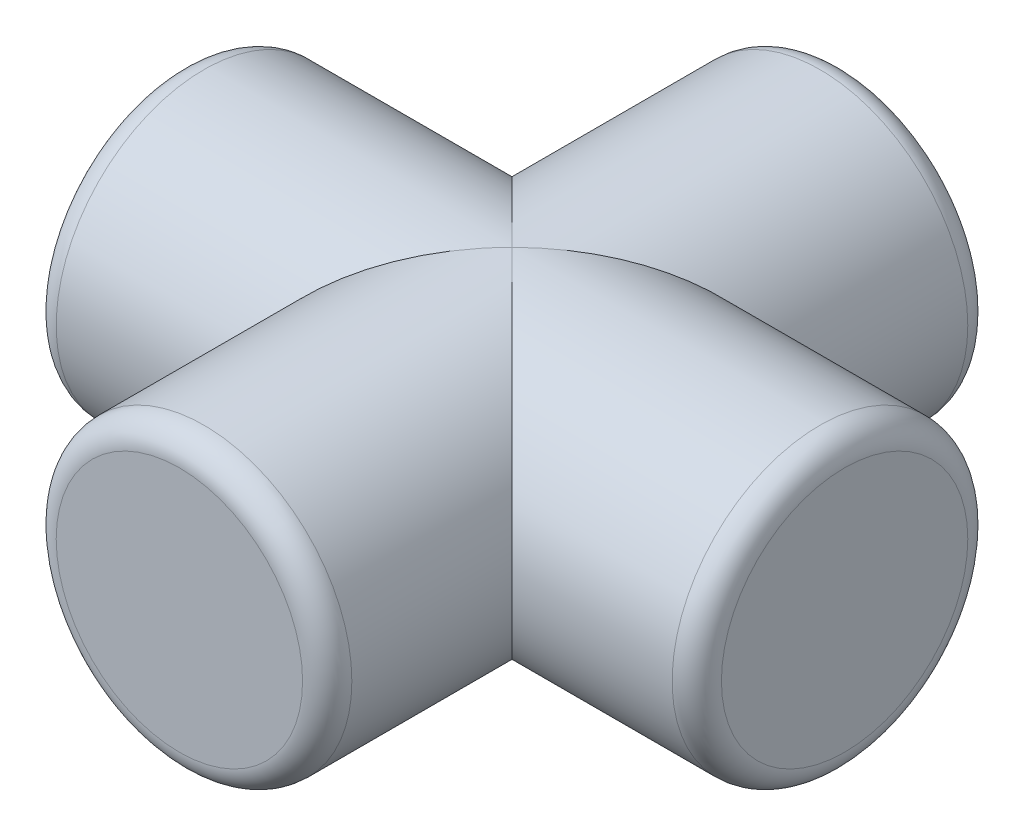
from build123d import *

# Parameters (mm, degrees)
SKETCH2_R                = 7.62
BOSS_EXTRUDE1_DEPTH      = 34.29
BOSS_EXTRUDE2_DEPTH      = 17.145
BOSS_EXTRUDE2_DEPTH_BACK = 17.145
SKETCH3_R                = 7.62
FILLET1_R                = 1.27


with BuildPart() as part:
    # Sketch2 → Boss-Extrude1 (new body)
    with BuildSketch(Plane.XY):
        Circle(SKETCH2_R)
    extrude(amount=BOSS_EXTRUDE1_DEPTH)

    # Sketch3 → Boss-Extrude2 (add, two sides: drawn at the far end of the back side and taken through both)
    with BuildSketch(Plane(origin=(0, 0, 0), x_dir=(0, 0, -1), z_dir=(1, 0, 0)).offset(-BOSS_EXTRUDE2_DEPTH_BACK)):
        with Locations((-17.145, 0)):
            Circle(SKETCH3_R)
    extrude(amount=BOSS_EXTRUDE2_DEPTH + BOSS_EXTRUDE2_DEPTH_BACK)

    # Fillet1
    fillet1_edges = [part.edges().sort_by_distance(p)[0] for p in [
        (-7.62, 0, 34.29),
        (17.145, 0, 24.765),
        (-17.145, 0, 24.765),
        (-7.62, 0, 0),
    ]]
    fillet(fillet1_edges, radius=FILLET1_R)


solid = part.part
